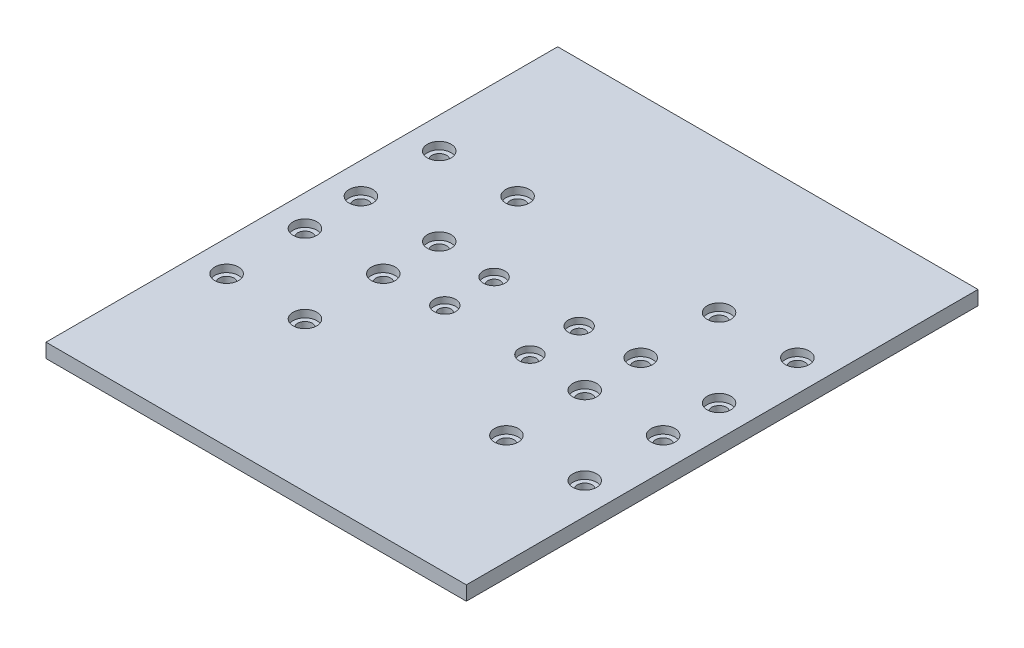
from build123d import *

# Parameters (mm, degrees)
SKETCH1_W        = 187.8
SKETCH1_H        = 228.6
EXTRUSION1_DEPTH = 6.35
HOLE4_D          = 6.6
HOLE5_D          = 5.5
HOLE6_D          = 10.6
HOLE6_DEPTH      = 3.3
HOLE7_D          = 9.6
HOLE7_DEPTH      = 2.75


with BuildPart() as part:
    # Sketch1 → Extrusion1 (new body)
    with BuildSketch(Plane(origin=(0, 0, 0), x_dir=(-1, 0, 0), z_dir=(0, 1, 0))):
        Rectangle(SKETCH1_W, SKETCH1_H)
    extrude(amount=EXTRUSION1_DEPTH)

    # Hole4 (through all)
    with Locations(Plane(origin=(0, 6.35, 0), x_dir=(1, 0, 0), z_dir=(0, 1, 0))):
        with Locations((-80.0034, 12.5), (-80.0034, 47.5), (-80.0034, -12.5), (-80.0034, -47.5), (-45.0034, -12.5), (-45.0034, -47.5), (-45.0034, 12.5), (-45.0034, 47.5), (80.0034, 47.5), (80.0034, 12.5), (80.0034, -12.5), (80.0034, -47.5), (45.0034, -47.5), (45.0034, -12.5), (45.0034, 12.5), (45.0034, 47.5)):
            Hole(HOLE4_D / 2)

    # Hole5 (through all)
    with Locations(Plane(origin=(0, 6.35, 0), x_dir=(1, 0, 0), z_dir=(0, 1, 0))):
        with Locations((-19, 11), (19, 11), (-19, -11), (19, -11)):
            Hole(HOLE5_D / 2)

    # Hole6
    with Locations(Plane(origin=(-80.0034, 6.35, -47.5), x_dir=(0, 0, -1), z_dir=(0, 1, 0))):
        with Locations((0, 0), (0, -35), (-35, -35), (-35, 0), (-60, 0), (-60, -35), (-95, -35), (-95, 0), (-95, -160.0068), (-60, -160.0068), (0, -160.0068), (-35, -160.0068), (0, -125.0068), (-35, -125.0068), (-95, -125.0068), (-60, -125.0068)):
            Hole(HOLE6_D / 2, depth=HOLE6_DEPTH)

    # Hole7
    with Locations(Plane(origin=(-19, 6.35, -11), x_dir=(0, 0, -1), z_dir=(0, 1, 0))):
        with Locations((0, 0), (0, -38), (-22, -38), (-22, 0)):
            Hole(HOLE7_D / 2, depth=HOLE7_DEPTH)


solid = part.part
